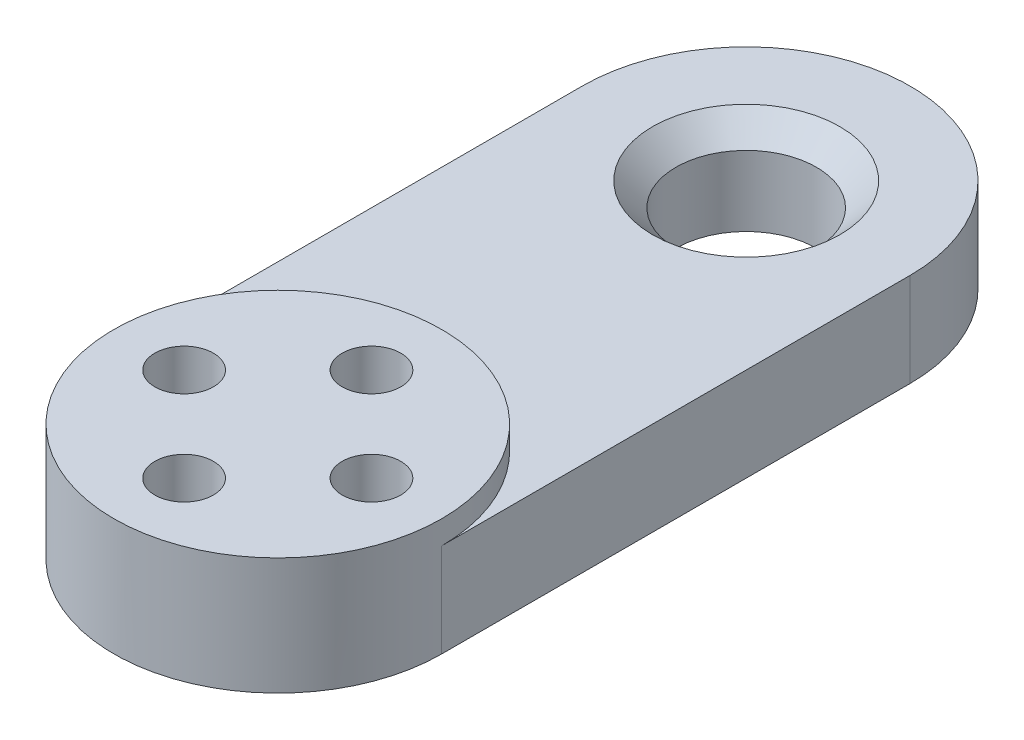
from build123d import *

# Parameters (mm, degrees)
SKETCH_1_R      = 1.25
SKETCH_1_R_2    = 3
EXTRUDE_1_DEPTH = 4
CHAMFER_1_SIZE  = 1
SKETCH_2_R      = 7
SKETCH_2_R_2    = 1.25
EXTRUDE_2_DEPTH = 1


with BuildPart() as part:
    # 草图1 → 凸台-拉伸1 (new body)
    with BuildSketch(Plane(origin=(0, 0, 0), x_dir=(1, 0, 0), z_dir=(0, 1, 0))):
        with BuildLine():
            Line((-7, 0), (-7, 20))
            ThreePointArc((-7, 20), (0, 27), (7, 20))
            Line((7, 20), (7, 0))
            ThreePointArc((7, 0), (0, -7), (-7, 0))
        make_face()
        with Locations(Location((0, 4, 0), (0, 0, 270))):
            Circle(SKETCH_1_R, mode=Mode.SUBTRACT)
        with Locations(Location((4, 0, 0), (0, 0, 270))):
            Circle(SKETCH_1_R, mode=Mode.SUBTRACT)
        with Locations(Location((0, -4, 0), (0, 0, 270))):
            Circle(SKETCH_1_R, mode=Mode.SUBTRACT)
        with Locations(Location((-4, 0, 0), (0, 0, 270))):
            Circle(SKETCH_1_R, mode=Mode.SUBTRACT)
        with Locations(Location((0, 20, 0), (0, 0, 270))):
            Circle(SKETCH_1_R_2, mode=Mode.SUBTRACT)
    extrude(amount=EXTRUDE_1_DEPTH)

    # 倒角1
    chamfer_1_edges = [part.edges().sort_by_distance(p)[0] for p in [
        (0, 4, -23),
    ]]
    chamfer(chamfer_1_edges, length=CHAMFER_1_SIZE)

    # 草图2 → 凸台-拉伸2 (add)
    with BuildSketch(Plane(origin=(0, 4, 0), x_dir=(1, 0, 0), z_dir=(0, 1, 0))):
        Circle(SKETCH_2_R)
        with Locations(Location((4, 0, 0), (0, 0, 270))):
            Circle(SKETCH_2_R_2, mode=Mode.SUBTRACT)
        with Locations(Location((0, 4, 0), (0, 0, 270))):
            Circle(SKETCH_2_R_2, mode=Mode.SUBTRACT)
        with Locations(Location((-4, 0, 0), (0, 0, 270))):
            Circle(SKETCH_2_R_2, mode=Mode.SUBTRACT)
        with Locations(Location((0, -4, 0), (0, 0, 270))):
            Circle(SKETCH_2_R_2, mode=Mode.SUBTRACT)
    extrude(amount=EXTRUDE_2_DEPTH)


solid = part.part
